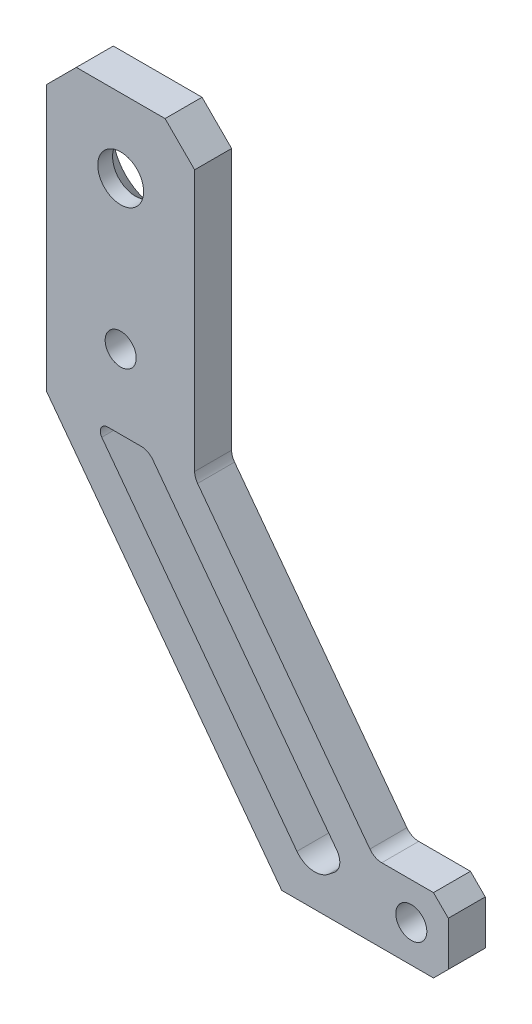
from build123d import *

# Parameters (mm, degrees)
SKETCH_1_R          = 2.1
SKETCH_1_R_2        = 3.1
EXTRUDE_1_DEPTH     = 2.5
FILLET_1_R          = 2
FILLET_2_R          = 3
CHAMFER_1_SIZE      = 4
CHAMFER_2_SIZE      = 2
FILLET_3_R          = 1
SKETCH_2_R          = 2.1
CUT_EXTRUDE_1_DEPTH = 5
CHAMFER_3_SIZE      = 3


with BuildPart() as part:
    # 草图1 → 凸台-拉伸1 (new, symmetric)
    with BuildSketch(Plane.XY):
        Polygon((-10, 10), (-10, -30), (21.776923077, -72.5), (44.3, -72.5), (44.3, -62.5), (34.3, -62.5), (10, -30), (10, 10), align=None)
        with Locations((39.3, -67.5)):
            Circle(SKETCH_1_R, mode=Mode.SUBTRACT)
        Circle(SKETCH_1_R_2, mode=Mode.SUBTRACT)
        Polygon((-3.756916253, -30), (3.756916253, -30), (30.3908691, -65.621541874), (25.686053977, -69.378458126), align=None, mode=Mode.SUBTRACT)
    extrude(amount=EXTRUDE_1_DEPTH, both=True)

    # 圆角1
    fillet_1_edges = [part.edges().sort_by_distance(p)[0] for p in [
        (10, -30, 0),
        (34.3, -62.5, 0),
        (30.3908691, -65.621541874, 0),
        (3.756916253, -30, 0),
    ]]
    fillet(fillet_1_edges, radius=FILLET_1_R)

    # 圆角2
    fillet_2_edges = [part.edges().sort_by_distance(p)[0] for p in [
        (25.686053977, -69.378458126, 0),
    ]]
    fillet(fillet_2_edges, radius=FILLET_2_R)

    # 倒角1
    chamfer_1_edges = [part.edges().sort_by_distance(p)[0] for p in [
        (10, 10, 0),
        (-10, 10, 0),
    ]]
    chamfer(chamfer_1_edges, length=CHAMFER_1_SIZE)

    # 倒角2
    chamfer_2_edges = [part.edges().sort_by_distance(p)[0] for p in [
        (44.3, -62.5, 0),
        (44.3, -72.5, 0),
    ]]
    chamfer(chamfer_2_edges, length=CHAMFER_2_SIZE)

    # 圆角3
    fillet_3_edges = [part.edges().sort_by_distance(p)[0] for p in [
        (-3.756916253, -30, 0),
    ]]
    fillet(fillet_3_edges, radius=FILLET_3_R)

    # 草图2 → 切除-拉伸1 (cut)
    with BuildSketch(Plane.XY.offset(2.5)):
        with Locations((0, -20)):
            Circle(SKETCH_2_R)
    extrude(amount=-CUT_EXTRUDE_1_DEPTH, mode=Mode.SUBTRACT)

    # 倒角3
    chamfer_3_edges = [part.edges().sort_by_distance(p)[0] for p in [
        (-3.1, 0, -2.5),
    ]]
    chamfer(chamfer_3_edges, length=CHAMFER_3_SIZE)


solid = part.part
